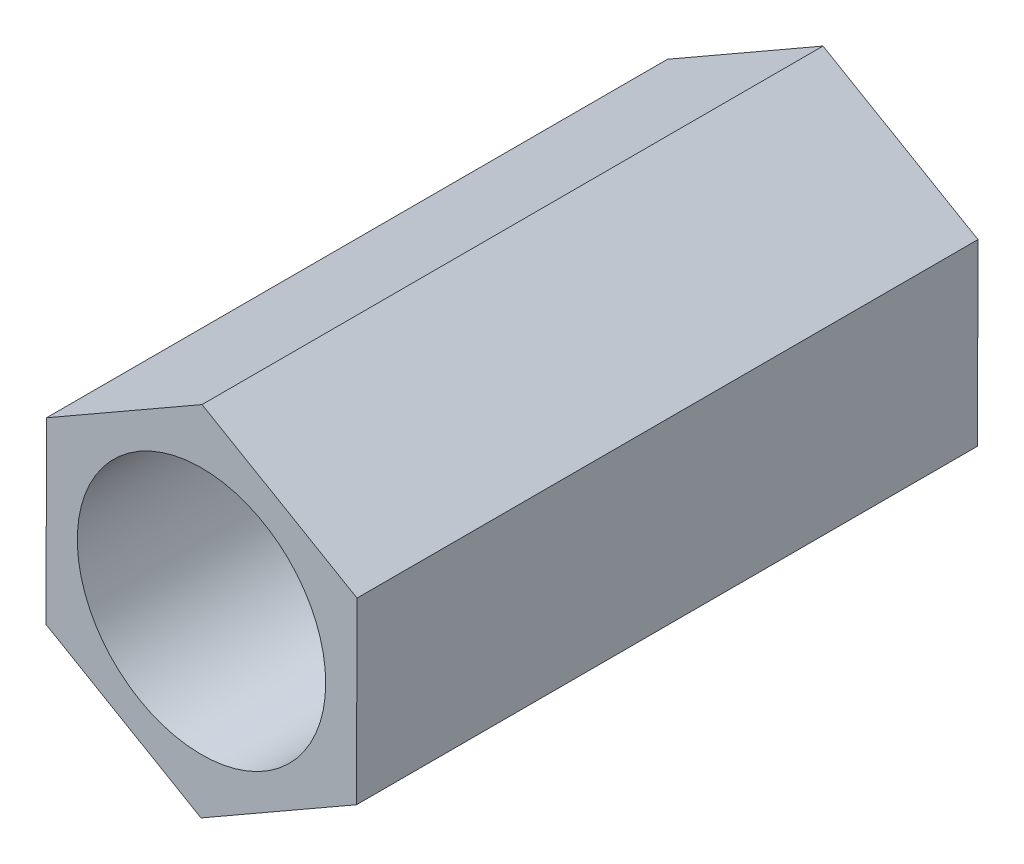
from build123d import *

# Parameters (mm, degrees)
BOSS_EXTRUDE1_DEPTH   = 10
F_4_0MM_DOWEL_HOLE1_D = 4


with BuildPart() as part:
    # Sketch1 → Boss-Extrude1 (new body)
    with BuildSketch(Plane.XY):
        Polygon((2.504220248, 1.436041184), (0.008461978, 2.886738944), (-2.49575827, 1.45069776), (-2.504220248, -1.436041184), (-0.008461978, -2.886738944), (2.49575827, -1.45069776), align=None)
    extrude(amount=BOSS_EXTRUDE1_DEPTH)

    # Ø4.0mm Dowel Hole1 (through all)
    with Locations(Plane.XY.offset(10)):
        with Locations((0, 0)):
            Hole(F_4_0MM_DOWEL_HOLE1_D / 2)


solid = part.part
